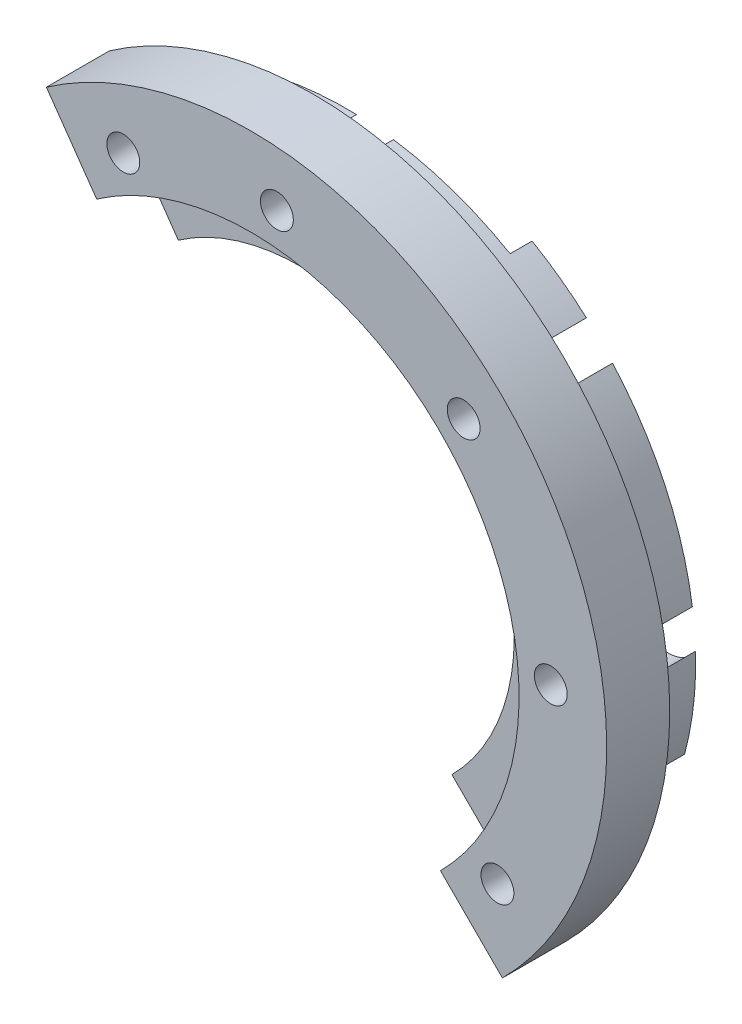
from build123d import *

# Parameters (mm, degrees)
BOSS_1_DEPTH  = 5.6
BOSS_2_DEPTH  = 4.95
CUT_3_DEPTH   = 1.1
CUT_4_DEPTH   = 1.1
CUT_5_DEPTH   = 1.1
CUT_6_DEPTH   = 1.1
CUT_7_DEPTH   = 1.7
CUT_8_DEPTH   = 1.7
CUT_9_DEPTH   = 1.9
CUT_10_DEPTH  = 2.9
S_HOLE11_R    = 1.2
HOLE_11_DEPTH = 8.8
S_HOLE12_R    = 2.3
HOLE_12_DEPTH = 3.1
S_HOLE13_R    = 1.2
HOLE_13_DEPTH = 8.8
S_HOLE14_R    = 2.3
HOLE_14_DEPTH = 3.1
S_HOLE15_R    = 1.2
HOLE_15_DEPTH = 8.8
S_HOLE16_R    = 2.3
HOLE_16_DEPTH = 3.1
S_HOLE17_R    = 1.2
HOLE_17_DEPTH = 8.8
S_HOLE18_R    = 2.3
HOLE_18_DEPTH = 3.1
S_HOLE19_R    = 1.2
HOLE_19_DEPTH = 8.8
S_HOLE20_R    = 2.3
HOLE_20_DEPTH = 3.1


with BuildPart() as part:
    # S_prism1 → Boss_1 (new body)
    with BuildSketch(Plane.XY.offset(24.6)):
        with BuildLine():
            Line((-14.912987345, 21.297953152), (-11.242098152, 16.055380068))
            ThreePointArc((-11.242098152, 16.055380068), (15.014471085, 12.59863715), (13.859292911, -13.859292911))
            Line((13.859292911, -13.859292911), (18.384776311, -18.384776311))
            ThreePointArc((18.384776311, -18.384776311), (19.917155521, 16.712477852), (-14.912987345, 21.297953152))
        make_face()
    extrude(amount=BOSS_1_DEPTH)

    # S_prism2 → Boss_2 (add)
    with BuildSketch(Plane.XY.offset(21.6)):
        with BuildLine():
            Line((-13.68454789, 19.594467307), (-8.932173518, 12.789694142))
            ThreePointArc((-8.932173518, 12.789694142), (11.950293313, 10.027486711), (11.044334296, -11.017380812))
            Line((11.044334296, -11.017380812), (16.920486517, -16.879192399))
            ThreePointArc((16.920486517, -16.879192399), (18.308462191, 15.362623872), (-13.68454789, 19.594467307))
        make_face()
    extrude(amount=BOSS_2_DEPTH)

    # S_pcut3 → Cut_3 (cut)
    with BuildSketch(Plane.XY.offset(24.5)):
        with BuildLine():
            Line((-15.39997361, 21.196245253), (-14.04806753, 19.335506166))
            ThreePointArc((-14.04806753, 19.335506166), (18.308462191, 15.362623872), (16.602335054, -17.192221228))
            Line((16.602335054, -17.192221228), (18.200049306, -18.846702769))
            ThreePointArc((18.200049306, -18.846702769), (20.07036441, 16.841035374), (-15.39997361, 21.196245253))
        make_face()
    extrude(amount=CUT_3_DEPTH, mode=Mode.SUBTRACT)

    # S_pcut4 → Cut_4 (cut)
    with BuildSketch(Plane.XY.offset(21.5)):
        with BuildLine():
            Line((-9.992349289, 13.753288904), (-9.110671411, 12.539763413))
            ThreePointArc((-9.110671411, 12.539763413), (11.873688868, 9.96320795), (10.767204742, -11.149766905))
            Line((10.767204742, -11.149766905), (11.809192298, -12.228776606))
            ThreePointArc((11.809192298, -12.228776606), (13.022755533, 10.927389365), (-9.992349289, 13.753288904))
        make_face()
    extrude(amount=CUT_4_DEPTH, mode=Mode.SUBTRACT)

    # S_pcut5 → Cut_5 (cut)
    with BuildSketch(Plane.XY.offset(21.5)):
        with BuildLine():
            Line((-10.697691592, 14.724109298), (-9.110671411, 12.539763413))
            ThreePointArc((-9.110671411, 12.539763413), (-0.811207322, 15.478757789), (7.75, 13.423393759))
            Line((7.75, 13.423393759), (9.1, 15.761662349))
            ThreePointArc((9.1, 15.761662349), (-0.952514404, 18.175057533), (-10.697691592, 14.724109298))
        make_face()
    extrude(amount=CUT_5_DEPTH, mode=Mode.SUBTRACT)

    # S_pcut6 → Cut_6 (cut)
    with BuildSketch(Plane.XY.offset(21.5)):
        with BuildLine():
            Line((18.545775865, -4.969325666), (14.971850307, -4.011695199))
            ThreePointArc((14.971850307, -4.011695199), (13.355251987, -7.866844626), (10.767204742, -11.149766905))
            Line((10.767204742, -11.149766905), (13.337440713, -13.811324167))
            ThreePointArc((13.337440713, -13.811324167), (16.54327988, -9.744736569), (18.545775865, -4.969325666))
        make_face()
    extrude(amount=CUT_6_DEPTH, mode=Mode.SUBTRACT)

    # S_pcut7 → Cut_7 (cut)
    with BuildSketch(Plane.XY.offset(21.5)):
        with BuildLine():
            Line((25.307256649, -6.781058982), (19.608294274, -5.254026616))
            ThreePointArc((19.608294274, -5.254026616), (17.491071957, -10.303028768), (14.10156492, -14.602597947))
            Line((14.10156492, -14.602597947), (18.200049306, -18.846702769))
            ThreePointArc((18.200049306, -18.846702769), (22.574684004, -13.29750511), (25.307256649, -6.781058982))
        make_face()
    extrude(amount=CUT_7_DEPTH, mode=Mode.SUBTRACT)

    # S_pcut8 → Cut_8 (cut)
    with BuildSketch(Plane.XY.offset(21.5)):
        with BuildLine():
            Line((-15.39997361, 21.196245253), (-11.932040622, 16.423044986))
            ThreePointArc((-11.932040622, 16.423044986), (-1.062419912, 20.272179556), (10.15, 17.580315697))
            Line((10.15, 17.580315697), (13.1, 22.689865579))
            ThreePointArc((13.1, 22.689865579), (-1.371202054, 26.164093811), (-15.39997361, 21.196245253))
        make_face()
    extrude(amount=CUT_8_DEPTH, mode=Mode.SUBTRACT)

    # S_pcut9 → Cut_9 (cut)
    with BuildSketch(Plane.XY.offset(21.5)):
        with BuildLine():
            Line((-15.39997361, 21.196245253), (-11.932040622, 16.423044986))
            ThreePointArc((-11.932040622, 16.423044986), (-8.739375265, 18.322481272), (-5.254026616, 19.608294274))
            Line((-5.254026616, 19.608294274), (-6.781058982, 25.307256649))
            ThreePointArc((-6.781058982, 25.307256649), (-11.279390736, 23.64773445), (-15.39997361, 21.196245253))
        make_face()
    extrude(amount=CUT_9_DEPTH, mode=Mode.SUBTRACT)

    # S_pcut10 → Cut_10 (cut)
    with BuildSketch(Plane.XY.offset(21.5)):
        with BuildLine():
            Line((-15.39997361, 21.196245253), (-12.519825874, 17.23206198))
            ThreePointArc((-12.519825874, 17.23206198), (-10.326444911, 18.629399762), (-7.97912044, 19.749016102))
            Line((-7.97912044, 19.749016102), (-9.814692747, 24.29221699))
            ThreePointArc((-9.814692747, 24.29221699), (-12.70201205, 22.915036327), (-15.39997361, 21.196245253))
        make_face()
    extrude(amount=CUT_10_DEPTH, mode=Mode.SUBTRACT)

    # S_hole11 → Hole_11 (cut)
    with BuildSketch(Plane.XY.offset(21.5)):
        with Locations((18.021344974, -12.6186816)):
            Circle(S_HOLE11_R)
    extrude(amount=HOLE_11_DEPTH, mode=Mode.SUBTRACT)

    # S_hole12 → Hole_12 (cut)
    with BuildSketch(Plane.XY.offset(21.5)):
        with Locations((18.021344974, -12.6186816)):
            Circle(S_HOLE12_R)
    extrude(amount=HOLE_12_DEPTH, mode=Mode.SUBTRACT)

    # S_hole13 → Hole_13 (cut)
    with BuildSketch(Plane.XY.offset(21.5)):
        with Locations((21.916283358, 1.91742634)):
            Circle(S_HOLE13_R)
    extrude(amount=HOLE_13_DEPTH, mode=Mode.SUBTRACT)

    # S_hole14 → Hole_14 (cut)
    with BuildSketch(Plane.XY.offset(21.5)):
        with Locations((21.916283358, 1.91742634)):
            Circle(S_HOLE14_R)
    extrude(amount=HOLE_14_DEPTH, mode=Mode.SUBTRACT)

    # S_hole15 → Hole_15 (cut)
    with BuildSketch(Plane.XY.offset(21.5)):
        with Locations((15.556349186, 15.556349186)):
            Circle(S_HOLE15_R)
    extrude(amount=HOLE_15_DEPTH, mode=Mode.SUBTRACT)

    # S_hole16 → Hole_16 (cut)
    with BuildSketch(Plane.XY.offset(21.5)):
        with Locations((15.556349186, 15.556349186)):
            Circle(S_HOLE16_R)
    extrude(amount=HOLE_16_DEPTH, mode=Mode.SUBTRACT)

    # S_hole17 → Hole_17 (cut)
    with BuildSketch(Plane.XY.offset(21.5)):
        with Locations((1.91742634, 21.916283358)):
            Circle(S_HOLE17_R)
    extrude(amount=HOLE_17_DEPTH, mode=Mode.SUBTRACT)

    # S_hole18 → Hole_18 (cut)
    with BuildSketch(Plane.XY.offset(21.5)):
        with Locations((1.91742634, 21.916283358)):
            Circle(S_HOLE18_R)
    extrude(amount=HOLE_18_DEPTH, mode=Mode.SUBTRACT)

    # S_hole19 → Hole_19 (cut)
    with BuildSketch(Plane.XY.offset(21.5)):
        with Locations(Location((-9.297601758, 19.938771315, 0), (0, 0, 241.964907162))):
            Circle(S_HOLE19_R)
    extrude(amount=HOLE_19_DEPTH, mode=Mode.SUBTRACT)

    # S_hole20 → Hole_20 (cut)
    with BuildSketch(Plane.XY.offset(21.5)):
        with Locations((-9.297601758, 19.938771315)):
            Circle(S_HOLE20_R)
    extrude(amount=HOLE_20_DEPTH, mode=Mode.SUBTRACT)


solid = part.part
